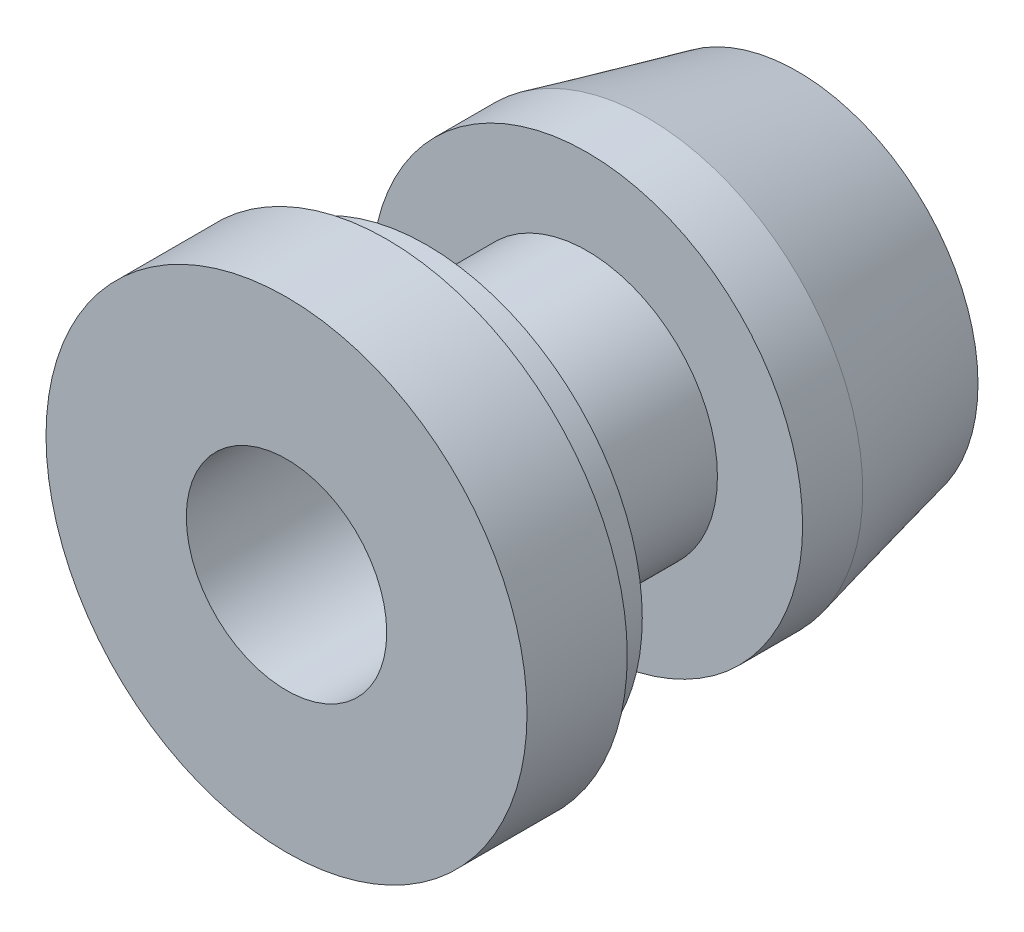
from build123d import *

# Parameters (mm, degrees)
ESQUISSE1_R             = 4.3
ESQUISSE1_R_2           = 2.6
ESQUISSE1_R_3           = 2
BOSS_EXTRU_1_DEPTH      = 1.2
ESQUISSE2_R             = 2.6
ESQUISSE2_R_2           = 2
BOSS_EXTRU_3_DEPTH      = 3.2
ESQUISSE3_R             = 4.3
ESQUISSE3_R_2           = 2
BOSS_EXTRU_4_DEPTH      = 0.8
ESQUISSE4_R             = 4.8
ESQUISSE4_R_2           = 2
BOSS_EXTRU_5_DEPTH      = 2
ESQUISSE6_R             = 3
ENL_V_MAT_EXTRU_1_DEPTH = 3


with BuildPart() as part:
    # Esquisse1 → Boss.-Extru.1 (new body)
    # profile 1 of 2: a face of its own
    with BuildSketch(Plane.XY):
        Circle(ESQUISSE1_R)
        Circle(ESQUISSE1_R_2, mode=Mode.SUBTRACT)
    # profile 2 of 2: a face of its own
    with BuildSketch(Plane.XY):
        Circle(ESQUISSE1_R_2)
        Circle(ESQUISSE1_R_3, mode=Mode.SUBTRACT)
    extrude(amount=BOSS_EXTRU_1_DEPTH)

    # Esquisse2 → Boss.-Extru.3 (add)
    with BuildSketch(Plane.XY.offset(1.2)):
        Circle(ESQUISSE2_R)
        Circle(ESQUISSE2_R_2, mode=Mode.SUBTRACT)
    extrude(amount=BOSS_EXTRU_3_DEPTH)

    # Esquisse3 → Boss.-Extru.4 (add)
    with BuildSketch(Plane.XY.offset(4.4)):
        Circle(ESQUISSE3_R)
        Circle(ESQUISSE3_R_2, mode=Mode.SUBTRACT)
    extrude(amount=BOSS_EXTRU_4_DEPTH)

    # Esquisse4 → Boss.-Extru.5 (add)
    with BuildSketch(Plane.XY.offset(5.2)):
        Circle(ESQUISSE4_R)
        Circle(ESQUISSE4_R_2, mode=Mode.SUBTRACT)
    extrude(amount=BOSS_EXTRU_5_DEPTH)

    # Esquisse5 → Révolution2 (revolve)
    with BuildSketch(Plane(origin=(0, 0, 0), x_dir=(1, 0, 0), z_dir=(0, 1, 0)), mode=Mode.PRIVATE) as r_volution2_sk:
        Polygon((-4.3, 0), (-3.599996072, 3), (0, 2.994682018), (0, 0), align=None)
    revolve(r_volution2_sk.sketch.rotate(Axis((0, 0, 7.316321581), (0, 0, -1)), 180), axis=Axis((0, 0, 7.316321581), (0, 0, -1)))

    # Esquisse6 → Enlèv. mat.-Extru.1 (cut)
    with BuildSketch(Plane(origin=(0, 0, 0), x_dir=(-1, 0, 0), z_dir=(0, 0, -1))):
        Circle(ESQUISSE6_R)
    extrude(amount=ENL_V_MAT_EXTRU_1_DEPTH, mode=Mode.SUBTRACT)


solid = part.part
